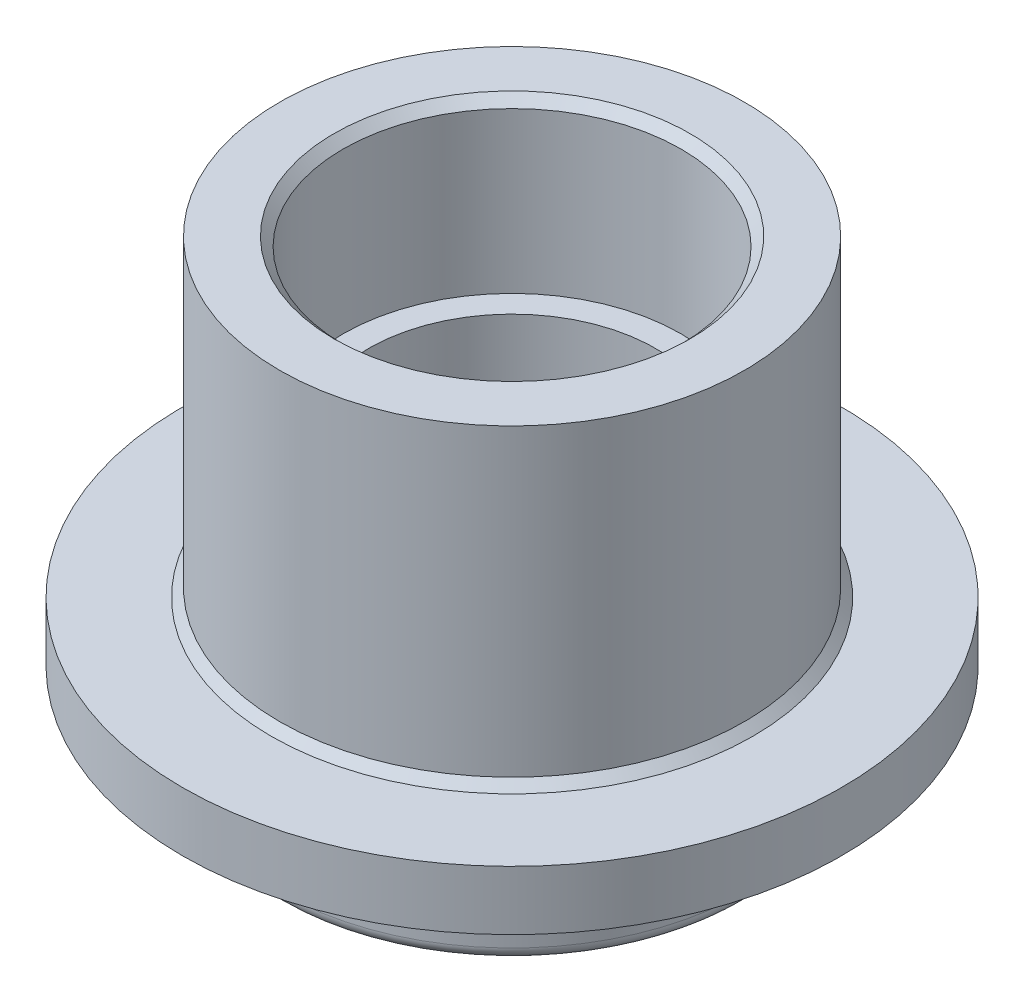
from build123d import *


with BuildPart() as part:
    # Esquisse1 → Révolution1 (revolve)
    with BuildSketch(Plane.XY, mode=Mode.PRIVATE) as r_volution1_sk:
        with BuildLine():
            Line((200, -60), (200, -180))
            Line((200, -180), (260, -180))
            ThreePointArc((260, -180), (270.606601718, -175.606601718), (275, -165))
            Line((275, -165), (275, -70))
            Line((275, -70), (390, -70))
            Line((390, -70), (390, 0))
            Line((390, 0), (285, 0))
            Line((285, 0), (275, 10))
            Line((275, 10), (275, 370))
            Line((275, 370), (210.606601718, 370))
            Line((210.606601718, 370), (200, 359.393398282))
            Line((200, 359.393398282), (200, 170))
            Line((200, 170), (170, 170))
            Line((170, 170), (170, -60))
            Line((170, -60), (200, -60))
        make_face()
    revolve(r_volution1_sk.sketch.rotate(Axis((0, 425.243902439, 0), (0, -1, 0)), 90), axis=Axis((0, 425.243902439, 0), (0, -1, 0)))


solid = part.part
